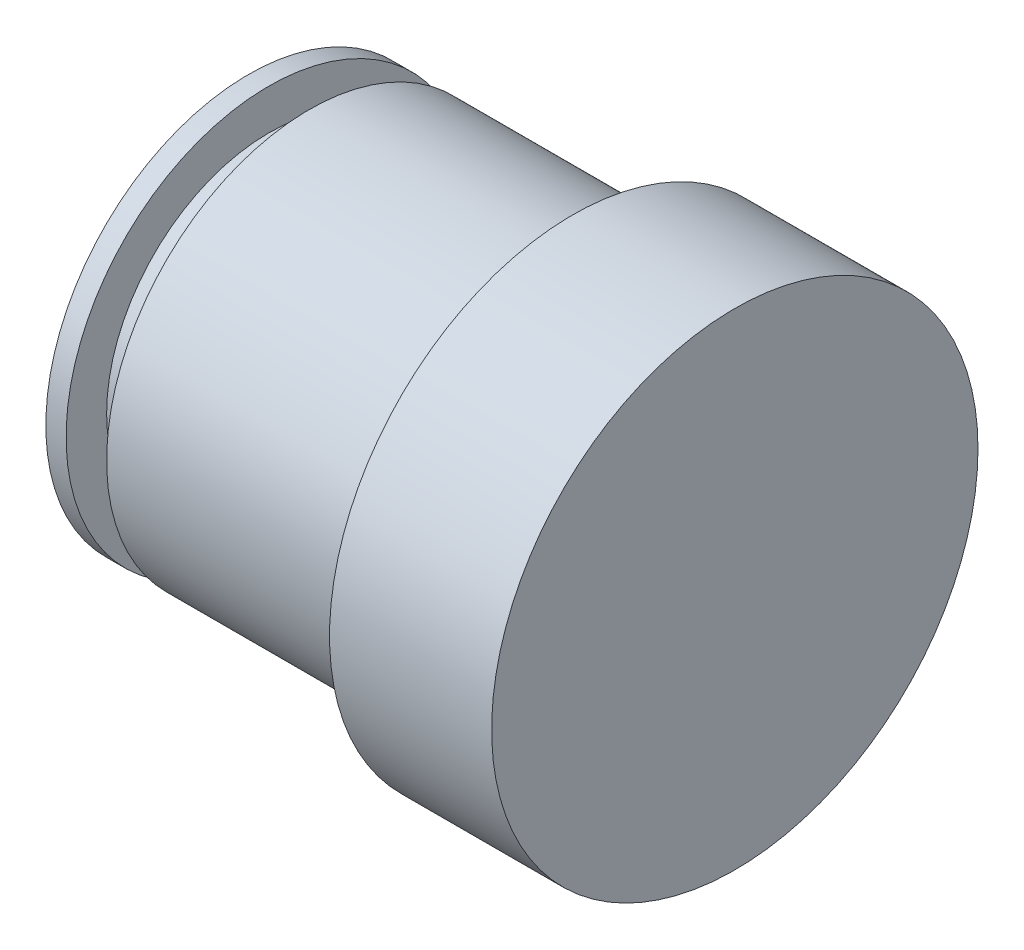
from build123d import *


with BuildPart() as part:
    # Sketch1 → Revolve1 (revolve)
    with BuildSketch(Plane(origin=(0, 0, 0), x_dir=(1, 0, 0), z_dir=(0, 1, 0))):
        with BuildLine():
            Line((0, 0), (0, 5))
            Line((0, 5), (0.5, 5))
            Line((0.5, 5), (0.5, 4))
            Line((0.5, 4), (1.5, 4))
            Line((1.5, 4), (1.5, 5))
            Line((1.5, 5), (7.5, 5))
            ThreePointArc((7.5, 5), (7.853553391, 5.146446609), (8, 5.5))
            Line((8, 5.5), (8, 6))
            Line((8, 6), (12, 6))
            Line((12, 6), (12, 0))
            Line((12, 0), (0, 0))
        make_face()
    revolve(axis=Axis((12, 0, 0), (-1, 0, 0)))


solid = part.part
